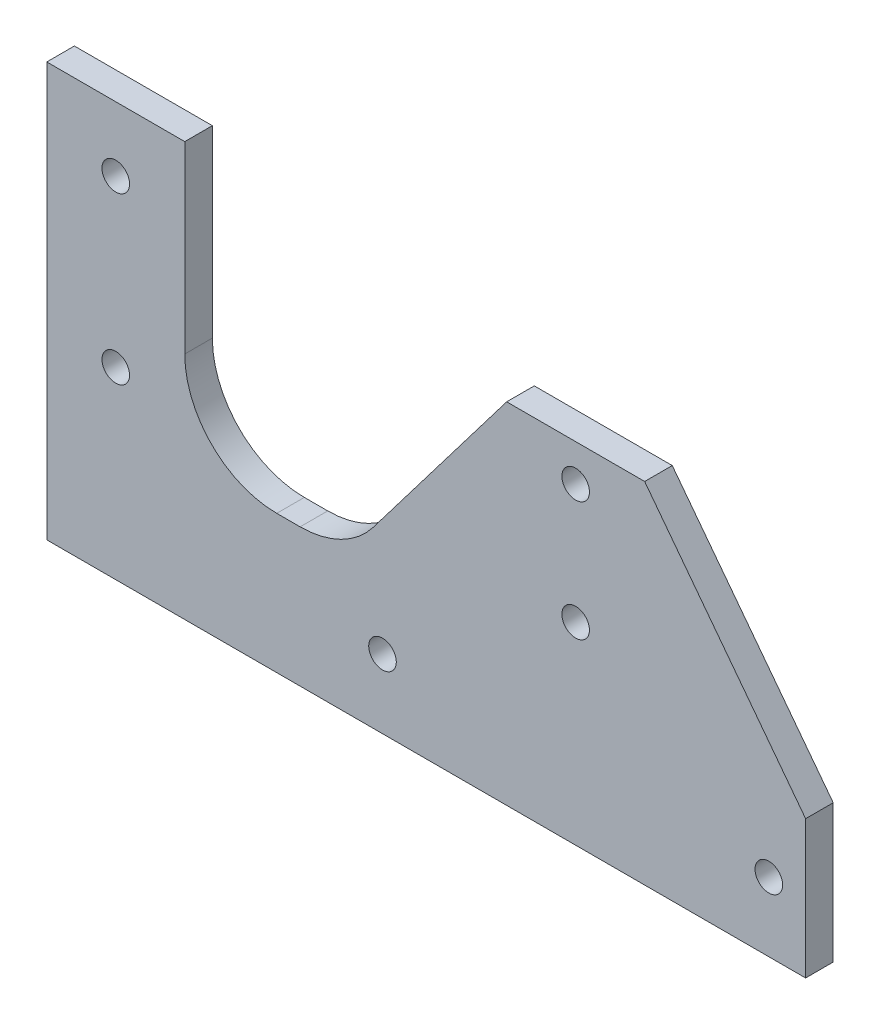
from build123d import *

# Parameters (mm, degrees)
EXTRUDE_1_DEPTH     = 3
SKETCH_2_R          = 1.5
CUT_EXTRUDE_1_DEPTH = 3


with BuildPart() as part:
    # 草图1 → 凸台-拉伸1 (new body)
    with BuildSketch(Plane.XY):
        with BuildLine():
            Line((-7.5, 0), (7.5, 0))
            Line((7.5, 0), (25, -23))
            Line((25, -23), (25, -38))
            Line((25, -38), (-25, -38))
            Line((-25, -38), (-57.5, -38))
            Line((-57.5, -38), (-57.5, 7))
            Line((-57.5, 7), (-42.5, 7))
            Line((-42.5, 7), (-42.5, -13))
            ThreePointArc((-42.5, -13), (-39.571067812, -20.071067812), (-32.5, -23))
            Line((-32.5, -23), (-29.956822623, -23))
            ThreePointArc((-29.956822623, -23), (-25.515661922, -21.959692608), (-21.998535682, -19.055218325))
            Line((-21.998535682, -19.055218325), (-7.5, 0))
        make_face()
    extrude(amount=EXTRUDE_1_DEPTH)

    # 草图2 → 切除-拉伸1 (cut)
    with BuildSketch(Plane.XY.offset(3)):
        with Locations((0, -4)):
            Circle(SKETCH_2_R)
        with Locations((0, -17)):
            Circle(SKETCH_2_R)
        with Locations((-21, -30.5)):
            Circle(SKETCH_2_R)
        with Locations((21, -30.5)):
            Circle(SKETCH_2_R)
        with Locations((-50, 0)):
            Circle(SKETCH_2_R)
        with Locations((-50, -18)):
            Circle(SKETCH_2_R)
    extrude(amount=-CUT_EXTRUDE_1_DEPTH, mode=Mode.SUBTRACT)


solid = part.part
